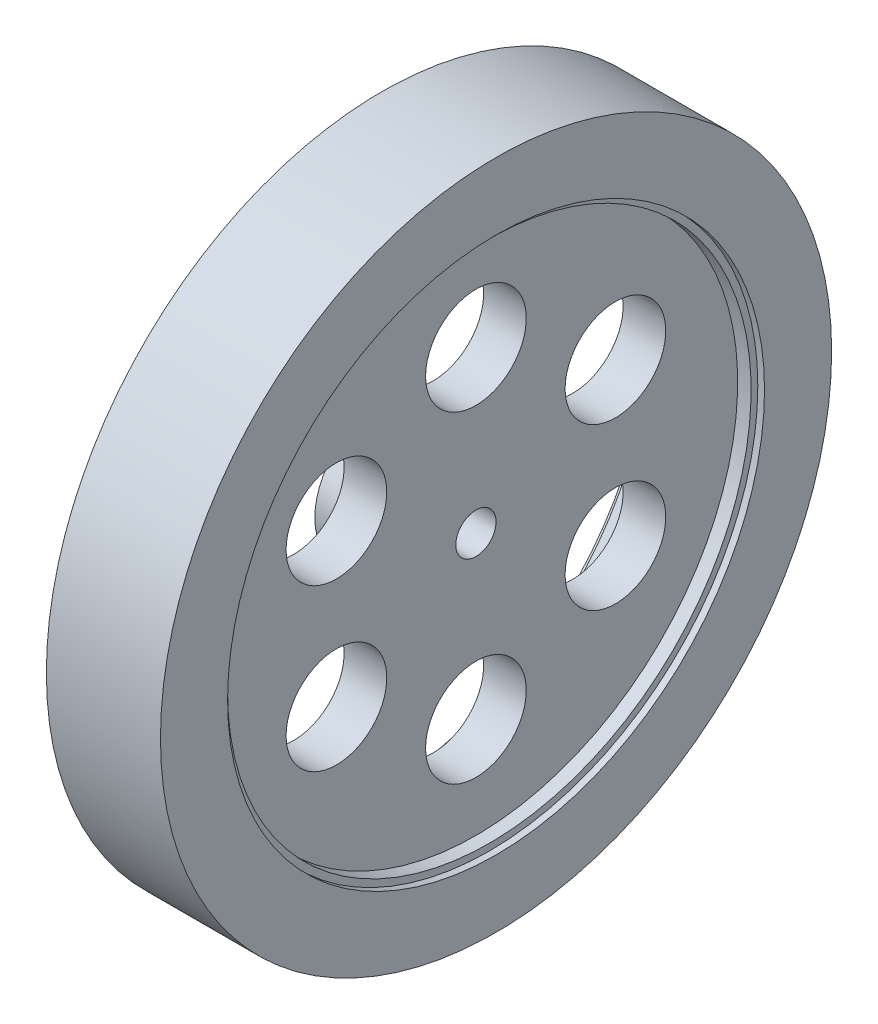
from build123d import *

# Parameters (mm, degrees)
SKETCH2_R          = 3.75
CUT_EXTRUDE1_DEPTH = 10


with BuildPart() as part:
    # Sketch1 → Revolve1 (revolve)
    with BuildSketch(Plane.XY, mode=Mode.PRIVATE) as revolve1_sk:
        Polygon((0, 1.5), (0, 19.5), (1, 19.5), (1, 20), (1.5, 20), (1.5, 25), (-7, 25), (-7, 20), (-6.5, 20), (-6.5, 19.5), (-3.175, 19.5), (-3.175, 5), (-7, 5), (-7, 1.5), (-3.175, 1.5), align=None)
    revolve(revolve1_sk.sketch.rotate(Axis((-3.175, 0, 0), (1, 0, 0)), 90), axis=Axis((-3.175, 0, 0), (1, 0, 0)))

    # Sketch2 → Cut-Extrude1 (cut)
    with BuildSketch(Plane.ZY.offset(3.175)):
        with Locations((0, 12)):
            Circle(SKETCH2_R)
        with Locations((10.392304845, 6)):
            Circle(SKETCH2_R)
        with Locations((10.392304845, -6)):
            Circle(SKETCH2_R)
        with Locations((0, -12)):
            Circle(SKETCH2_R)
        with Locations((-10.392304845, -6)):
            Circle(SKETCH2_R)
        with Locations((-10.392304845, 6)):
            Circle(SKETCH2_R)
    extrude(amount=-CUT_EXTRUDE1_DEPTH, mode=Mode.SUBTRACT)


solid = part.part
